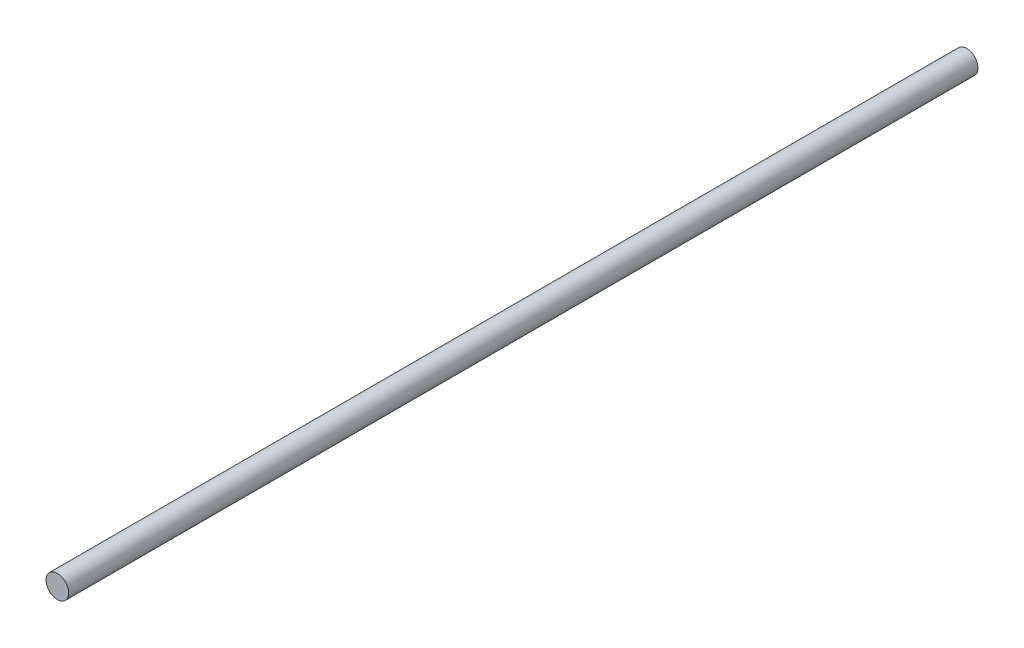
from build123d import *

# Parameters (mm, degrees)
SKETCH1_R           = 1
BOSS_EXTRUDE1_DEPTH = 80


with BuildPart() as part:
    # Sketch1 → Boss-Extrude1 (new body)
    with BuildSketch(Plane.XY):
        Circle(SKETCH1_R)
    extrude(amount=BOSS_EXTRUDE1_DEPTH)


solid = part.part
